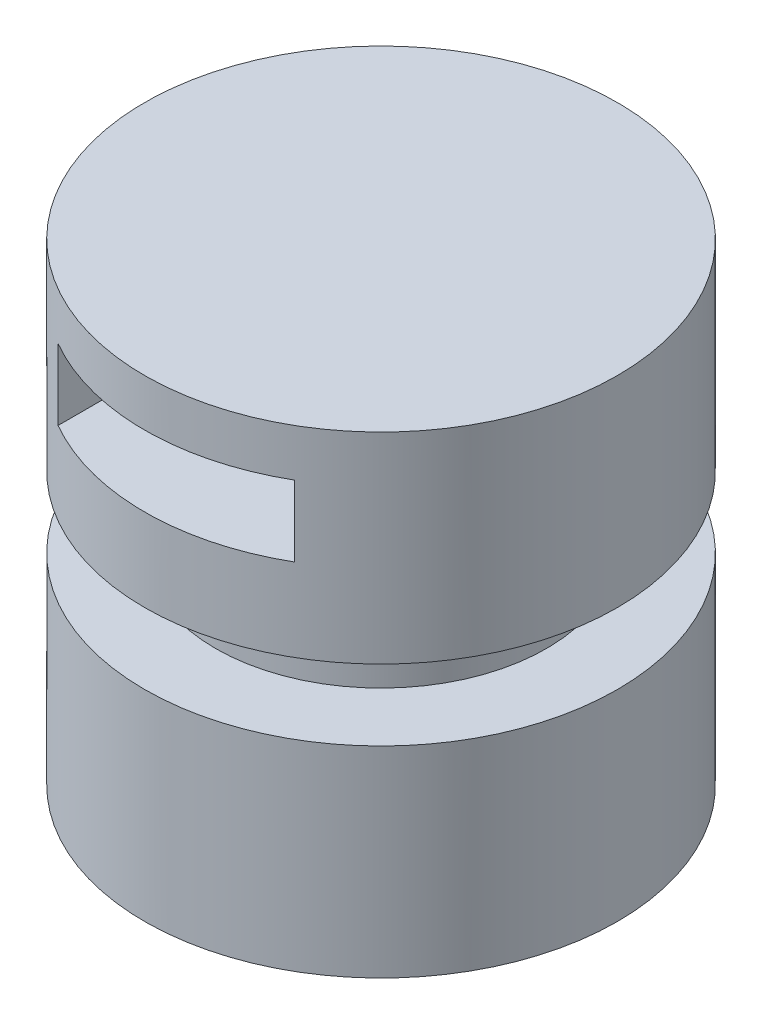
from build123d import *

# Parameters (mm, degrees)
SKETCH1_W               = 2540
SKETCH1_H               = 5080
SKETCH2_W               = 762
SKETCH2_H               = 762
CUT_EXTRUDE1_DEPTH      = 6222.703946669
CUT_EXTRUDE1_DEPTH_BACK = 6222.703946669
SKETCH3_W               = 2540
SKETCH3_H               = 762


with BuildPart() as part:
    # Sketch1 → Revolve1 (revolve)
    with BuildSketch(Plane.XY):
        with Locations((1270, 2540)):
            Rectangle(SKETCH1_W, SKETCH1_H)
    revolve(axis=Axis((0, 0, 0), (0, 1, 0)))

    # Sketch2 → Cut-Revolve1 (revolve, cut)
    with BuildSketch(Plane.XY):
        with Locations((2159, 2540)):
            Rectangle(SKETCH2_W, SKETCH2_H)
    revolve(axis=Axis((0, 5080, 0), (0, -1, 0)), mode=Mode.SUBTRACT)

    # Sketch3 → Cut-Extrude1 (cut, two sides: drawn at the far end of the back side and taken through both)
    with BuildSketch(Plane.XY.offset(-CUT_EXTRUDE1_DEPTH_BACK)):
        with Locations((0, 4191)):
            Rectangle(SKETCH3_W, SKETCH3_H)
    extrude(amount=CUT_EXTRUDE1_DEPTH + CUT_EXTRUDE1_DEPTH_BACK, mode=Mode.SUBTRACT)


solid = part.part
